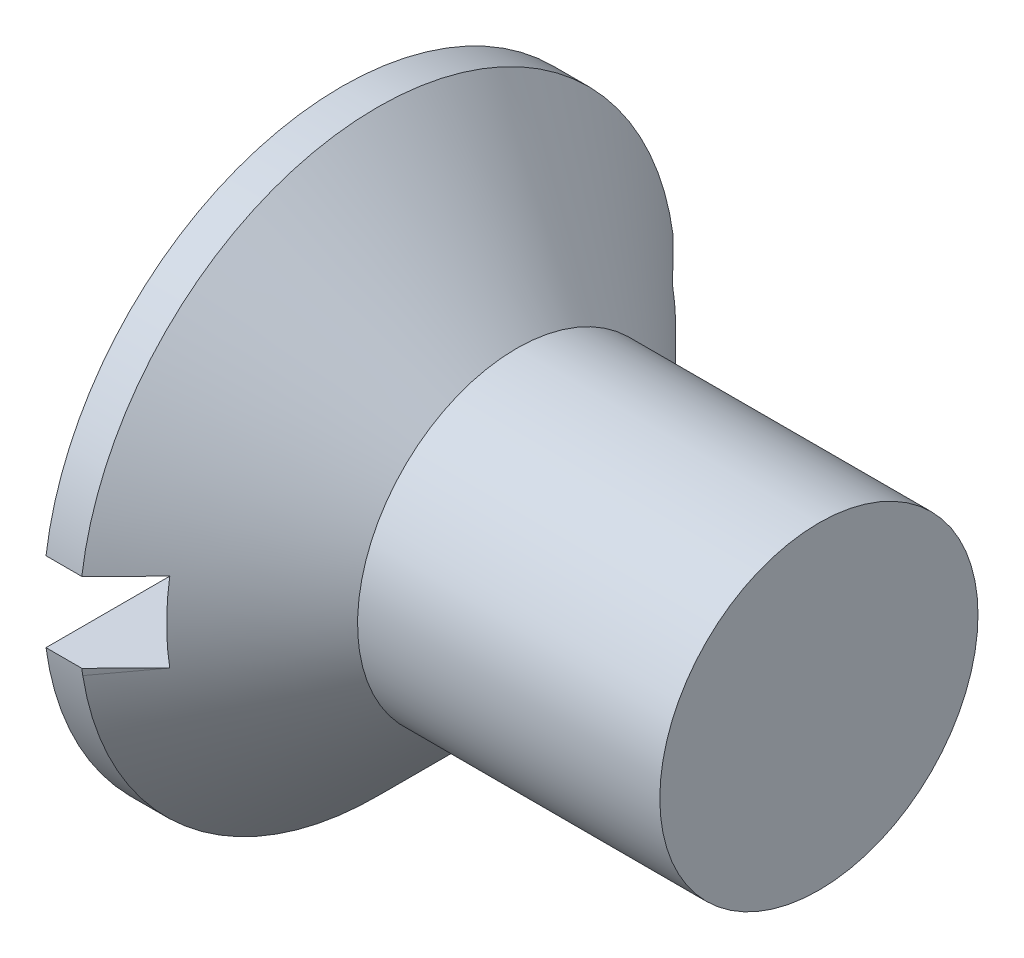
from build123d import *

# Parameters (mm, degrees)
SKETCH2_W          = 7.5
SKETCH2_H          = 1
CUT_EXTRUDE1_DEPTH = 1


with BuildPart() as part:
    # Sketch1 → Revolve1 (revolve)
    with BuildSketch(Plane.XY):
        Polygon((0, 0), (0, 3.75), (0.45, 3.75), (2.2, 2), (6, 2), (6, 0), align=None)
    revolve(axis=Axis((6, 0, 0), (-1, 0, 0)))

    # Sketch2 → Cut-Extrude1 (cut)
    with BuildSketch(Plane.ZY):
        Rectangle(SKETCH2_W, SKETCH2_H)
    extrude(amount=-CUT_EXTRUDE1_DEPTH, mode=Mode.SUBTRACT)


solid = part.part
